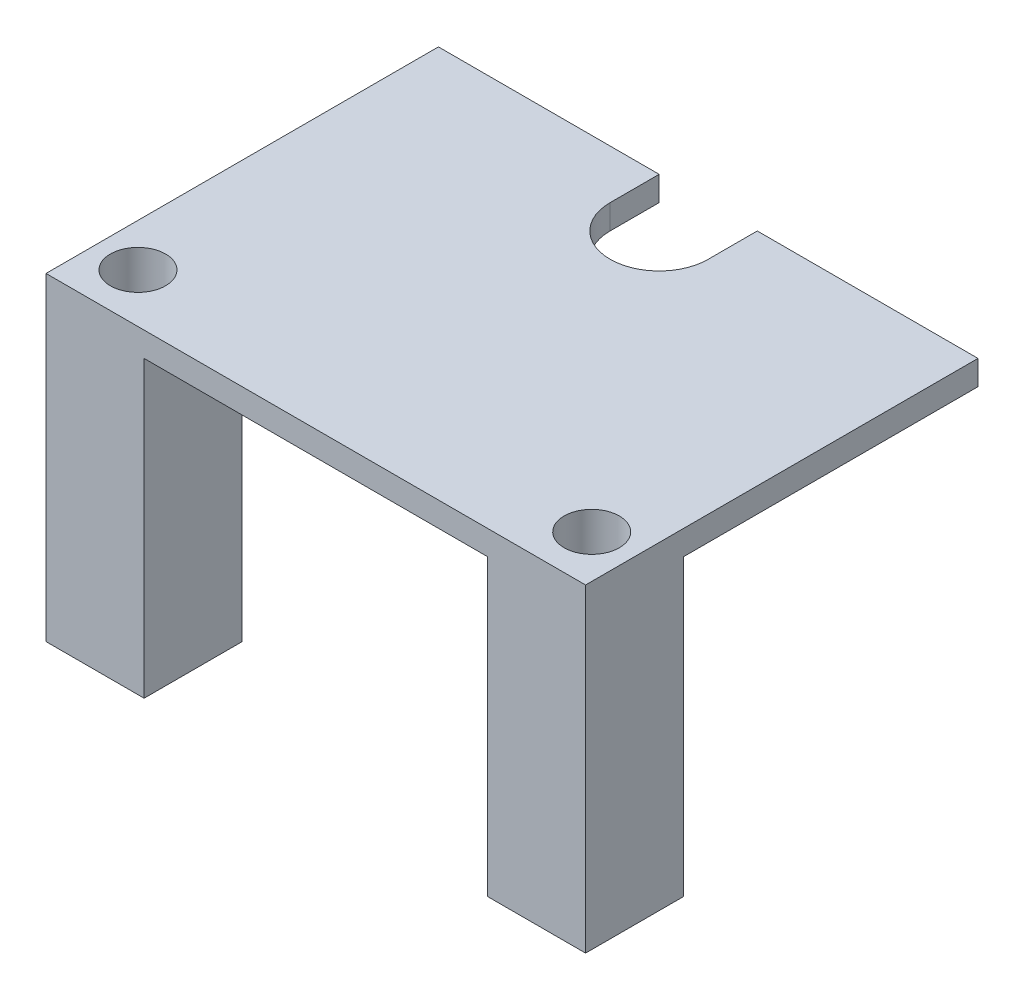
from build123d import *

# Parameters (mm, degrees)
BOSS_EXTRUDE1_DEPTH                                  = 69.85
SKETCH2_W                                            = 88.9
SKETCH2_H                                            = 76.2
CUT_EXTRUDE1_DEPTH                                   = 149.378182358
CBORE_FOR_1_4_BINDING_HEAD_MACHINE_SCREW_D           = 6.7564
CBORE_FOR_1_4_BINDING_HEAD_MACHINE_SCREW_CBORE_D     = 14.2875
CBORE_FOR_1_4_BINDING_HEAD_MACHINE_SCREW_CBORE_DEPTH = 64.191007
CUT_EXTRUDE2_DEPTH                                   = 140.9883388


with BuildPart() as part:
    # Sketch1 → Boss-Extrude1 (new, symmetric)
    with BuildSketch(Plane(origin=(0, 0, 0), x_dir=(0, 0, -1), z_dir=(1, 0, 0))):
        Polygon((-12.7, 0), (12.7, 0), (12.7, 76.2), (88.9, 76.2), (88.9, 82.55), (-12.7, 82.55), align=None)
    extrude(amount=BOSS_EXTRUDE1_DEPTH, both=True)

    # Sketch2 → Cut-Extrude1 (cut, through all)
    with BuildSketch(Plane(origin=(0, 0, -88.9), x_dir=(-1, 0, 0), z_dir=(0, 0, -1))):
        with Locations((0, 38.1)):
            Rectangle(SKETCH2_W, SKETCH2_H)
    extrude(amount=-CUT_EXTRUDE1_DEPTH, mode=Mode.SUBTRACT)

    # CBORE for 1/4 Binding Head Machine Screw1 (through all)
    with Locations(Plane(origin=(0, 82.55, 0), x_dir=(1, 0, 0), z_dir=(0, 1, 0))):
        with Locations((58.7375, 0), (-58.7375, 0)):
            CounterBoreHole(CBORE_FOR_1_4_BINDING_HEAD_MACHINE_SCREW_D / 2, CBORE_FOR_1_4_BINDING_HEAD_MACHINE_SCREW_CBORE_D / 2, CBORE_FOR_1_4_BINDING_HEAD_MACHINE_SCREW_CBORE_DEPTH)

    # Sketch6 → Cut-Extrude2 (cut, through all)
    with BuildSketch(Plane(origin=(0, 82.55, 0), x_dir=(1, 0, 0), z_dir=(0, 1, 0))):
        with BuildLine():
            Line((12.7, 76.2), (12.7, 88.9))
            Line((12.7, 88.9), (-12.7, 88.9))
            Line((-12.7, 88.9), (-12.7, 76.2))
            ThreePointArc((-12.7, 76.2), (0, 63.5), (12.7, 76.2))
        make_face()
    extrude(amount=-CUT_EXTRUDE2_DEPTH, mode=Mode.SUBTRACT)


solid = part.part
